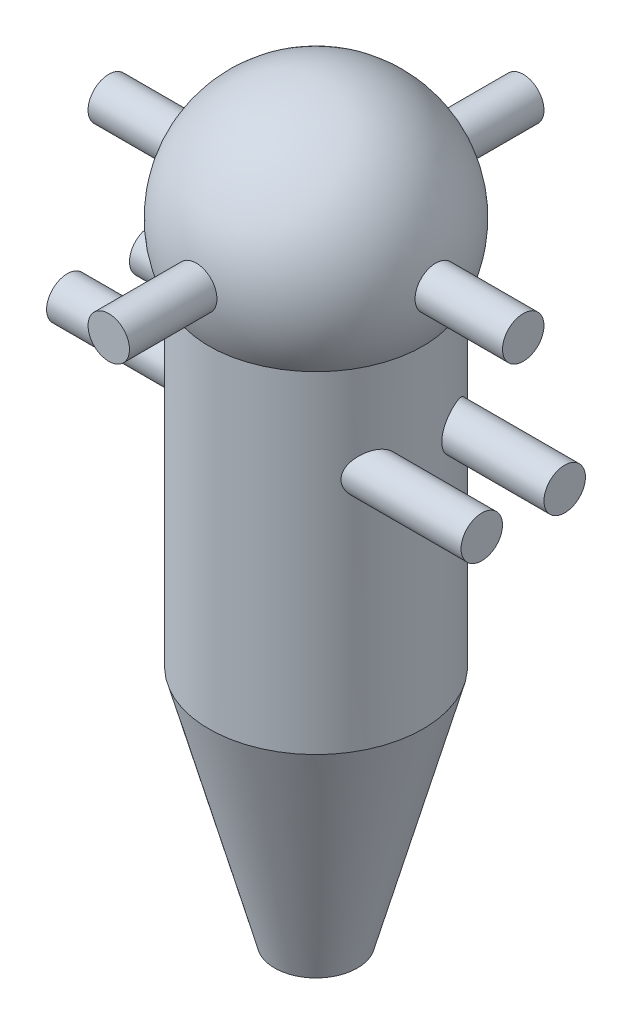
from build123d import *

# Parameters (mm, degrees)
BOSS_EXTRUDE1_DEPTH      = 15
BOSS_EXTRUDE1_DEPTH_BACK = 15
SKETCH4_R                = 1.5
BOSS_EXTRUDE2_DEPTH      = 15
BOSS_EXTRUDE2_DEPTH_BACK = 15
SKETCH6_R                = 1.5


with BuildPart() as part:
    # Sketch1 → Revolve1 (revolve)
    with BuildSketch(Plane.XY):
        with BuildLine():
            Line((-7.75, 54.212646434), (-7.75, 30.212646434))
            Line((-7.75, 30.212646434), (-3, 12.850690899))
            Line((-3, 12.850690899), (0, 12.850690899))
            Line((0, 12.850690899), (0, 67.181279304))
            ThreePointArc((0, 67.181279304), (-7.553938352, 62.895480825), (-7.75, 54.212646434))
        make_face()
    revolve(axis=Axis((0, 0, 0), (0, 1, 0)))

    # Sketch4 → Boss-Extrude1 (add, two sides: drawn at the far end of the back side and taken through both)
    with BuildSketch(Plane.XY.offset(-BOSS_EXTRUDE1_DEPTH_BACK)):
        with Locations((0, 58.381279304)):
            Circle(SKETCH4_R)
    extrude(amount=BOSS_EXTRUDE1_DEPTH + BOSS_EXTRUDE1_DEPTH_BACK)

    # Sketch6 → Boss-Extrude2 (add, two sides: drawn at the far end of the back side and taken through both)
    with BuildSketch(Plane(origin=(0, 0, 0), x_dir=(0, 0, -1), z_dir=(1, 0, 0)).offset(-BOSS_EXTRUDE2_DEPTH_BACK)):
        with Locations((0, 58.381279304)):
            Circle(SKETCH6_R)
        with Locations((3, 47.381279304)):
            Circle(SKETCH6_R)
        with Locations((-3, 47.381279304)):
            Circle(SKETCH6_R)
    extrude(amount=BOSS_EXTRUDE2_DEPTH + BOSS_EXTRUDE2_DEPTH_BACK)


solid = part.part
